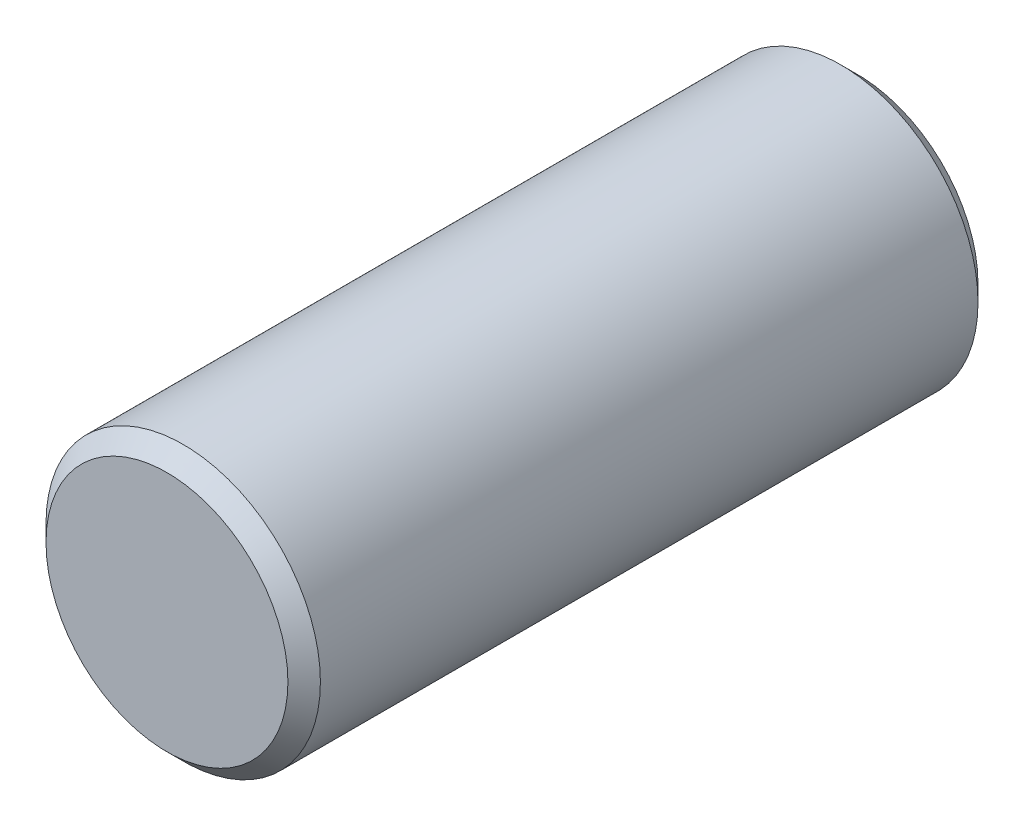
from build123d import *

# Parameters (mm, degrees)
SKETCH1_R           = 16.9
BOSS_EXTRUDE1_DEPTH = 42.5
CHAMFER1_SIZE       = 2
CHAMFER2_SIZE       = 2


with BuildPart() as part:
    # Sketch1 → Boss-Extrude1 (new, symmetric)
    with BuildSketch(Plane.XY):
        Circle(SKETCH1_R)
    extrude(amount=BOSS_EXTRUDE1_DEPTH, both=True)

    # Chamfer1
    chamfer1_edges = [part.edges().sort_by_distance(p)[0] for p in [
        (-16.9, 0, 42.5),
    ]]
    chamfer(chamfer1_edges, length=CHAMFER1_SIZE)

    # Chamfer2
    chamfer2_edges = [part.edges().sort_by_distance(p)[0] for p in [
        (-16.9, 0, -42.5),
    ]]
    chamfer(chamfer2_edges, length=CHAMFER2_SIZE)


solid = part.part
